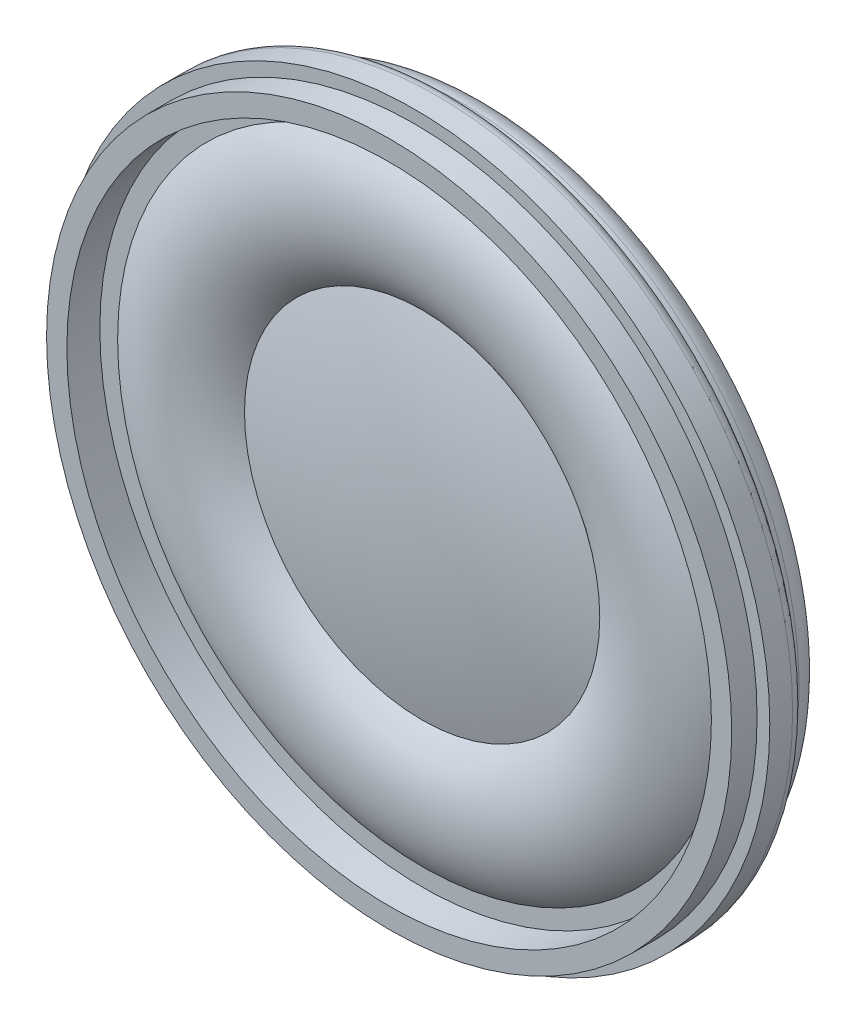
from build123d import *

# Parameters (mm, degrees)
EXTRUDE_2_DEPTH = 0.4


with BuildPart() as part:
    # Эскиз1 → Повернуть2 (revolve)
    with BuildSketch(Plane(origin=(0, 0, 0), x_dir=(1, 0, 0), z_dir=(0, 1, 0))):
        with BuildLine():
            Line((0, 0), (7.5, 0))
            ThreePointArc((7.5, 0), (7.853553391, -0.146446609), (8, -0.5))
            Line((8, -0.5), (8, -1.5))
            Line((8, -1.5), (12.25, -1.5))
            ThreePointArc((12.25, -1.5), (12.957106781, -1.792893219), (13.25, -2.5))
            Line((13.25, -2.5), (13.25, -3))
            Line((13.25, -3), (13.5, -3))
            ThreePointArc((13.5, -3), (13.853553391, -3.146446609), (14, -3.5))
            Line((14, -3.5), (14, -4.4))
            Line((14, -4.4), (13.5, -4.4))
            Line((13.5, -4.4), (13.5, -5.4))
            Line((13.5, -5.4), (12.7, -5.4))
            Line((12.7, -5.4), (12.7, -4.1))
            Line((12.7, -4.1), (12, -4.1))
            ThreePointArc((12, -4.1), (9.5, -5), (7, -4.1))
            ThreePointArc((7, -4.1), (3.528809998, -4.77407776), (0, -5))
            Line((0, -5), (0, 0))
        make_face()
    revolve(axis=Axis((0, 0, 0), (0, 0, 1)))

    # Эскиз2 → Бобышка-Вытянуть2 (add)
    with BuildSketch(Plane(origin=(0, 0, 1.5), x_dir=(-1, 0, 0), z_dir=(0, 0, -1))):
        with BuildLine():
            Line((-5.564516129, 6.589900246), (-7.5, 8.882039462))
            ThreePointArc((-7.5, 8.882039462), (0, 11.625), (7.5, 8.882039462))
            Line((7.5, 8.882039462), (5.564516129, 6.589900246))
            ThreePointArc((5.564516129, 6.589900246), (0, 8.625), (-5.564516129, 6.589900246))
        make_face()
    extrude(amount=EXTRUDE_2_DEPTH)


solid = part.part
